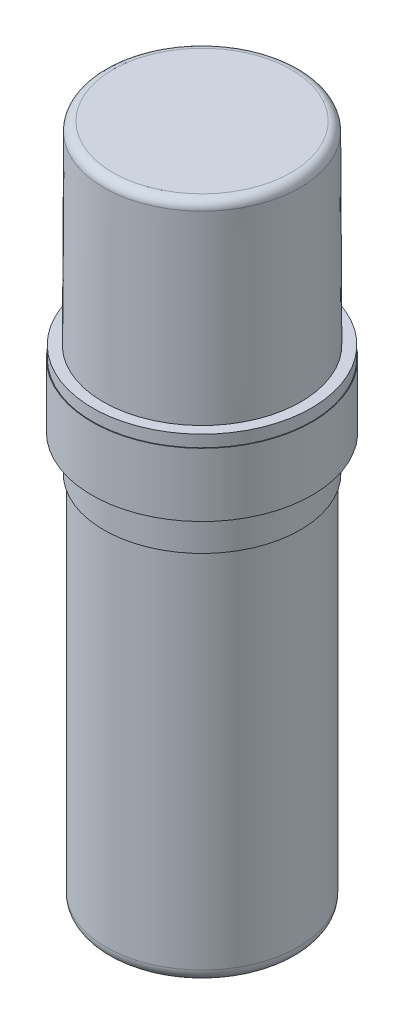
from build123d import *

# Parameters (mm, degrees)
FILLET1_R = 2
FILLET2_R = 3


with BuildPart() as part:
    # Sketch1 → Revolve1 (revolve)
    with BuildSketch(Plane.XY, mode=Mode.PRIVATE) as revolve1_sk:
        Polygon((0, 0), (0, 154.2), (22.2, 154.2), (22.4, 110.3), (24.8, 110.3), (24.8, 107.63), (24.95, 107.63), (24.95, 93.26), (22.25, 93.26), (22.25, 85.09), (21.75, 85.09), (21.75, 0), align=None)
    revolve(revolve1_sk.sketch.rotate(Axis((0, 0, 0), (0, 1, 0)), 90), axis=Axis((0, 0, 0), (0, 1, 0)))

    # Fillet1
    fillet1_edges = [part.edges().sort_by_distance(p)[0] for p in [
        (0, 154.2, 22.2),
    ]]
    fillet(fillet1_edges, radius=FILLET1_R)

    # Fillet2
    fillet2_edges = [part.edges().sort_by_distance(p)[0] for p in [
        (0, 0, 21.75),
    ]]
    fillet(fillet2_edges, radius=FILLET2_R)


solid = part.part
